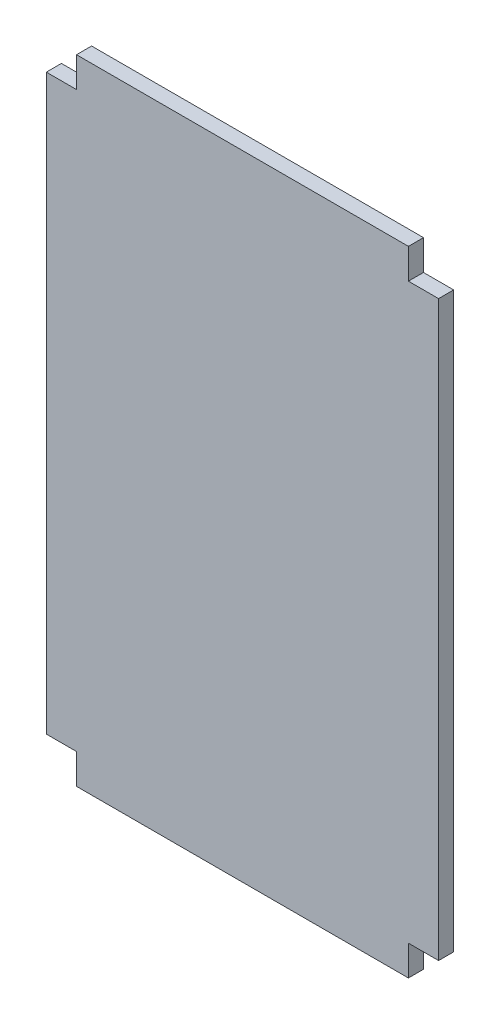
from build123d import *

# Parameters (mm, degrees)
SKETCH2_W           = 520
SKETCH2_H           = 840
BOSS_EXTRUDE1_DEPTH = 20
SKETCH3_W           = 40
SKETCH3_H           = 40
CUT_EXTRUDE1_DEPTH  = 30


with BuildPart() as part:
    # Sketch2 → Boss-Extrude1 (new body)
    with BuildSketch(Plane.XY):
        with Locations((260, 420)):
            Rectangle(SKETCH2_W, SKETCH2_H)
    extrude(amount=BOSS_EXTRUDE1_DEPTH)

    # Sketch3 → Cut-Extrude1 (cut)
    with BuildSketch(Plane(origin=(0, 0, 0), x_dir=(-1, 0, 0), z_dir=(0, 0, -1))):
        with Locations((-500, 820)):
            Rectangle(SKETCH3_W, SKETCH3_H)
        with Locations((-20, 820)):
            Rectangle(SKETCH3_W, SKETCH3_H)
        with Locations((-500, 20)):
            Rectangle(SKETCH3_W, SKETCH3_H)
        with Locations((-20, 20)):
            Rectangle(SKETCH3_W, SKETCH3_H)
    extrude(amount=-CUT_EXTRUDE1_DEPTH, mode=Mode.SUBTRACT)


solid = part.part
